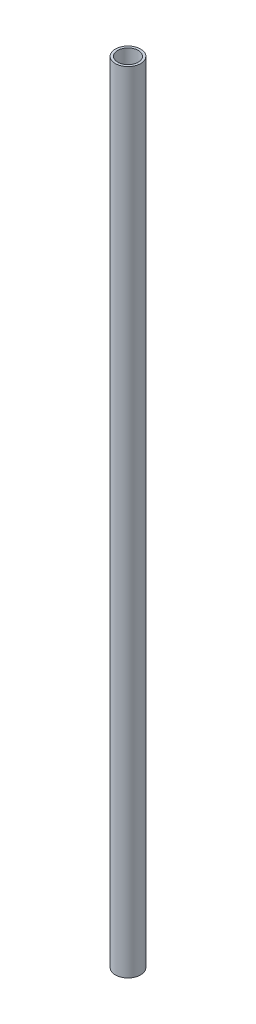
from build123d import *

# Parameters (mm, degrees)
SKETCH1_R           = 8
SKETCH1_R_2         = 6.5
BOSS_EXTRUDE1_DEPTH = 500


with BuildPart() as part:
    # Sketch1 → Boss-Extrude1 (new body)
    with BuildSketch(Plane(origin=(0, 0, 0), x_dir=(1, 0, 0), z_dir=(0, 1, 0))):
        with Locations(Location((0, 0, 0), (0, 0, 270))):
            Circle(SKETCH1_R)
        with Locations(Location((0, 0, 0), (0, 0, 270))):
            Circle(SKETCH1_R_2, mode=Mode.SUBTRACT)
    extrude(amount=BOSS_EXTRUDE1_DEPTH)


solid = part.part
